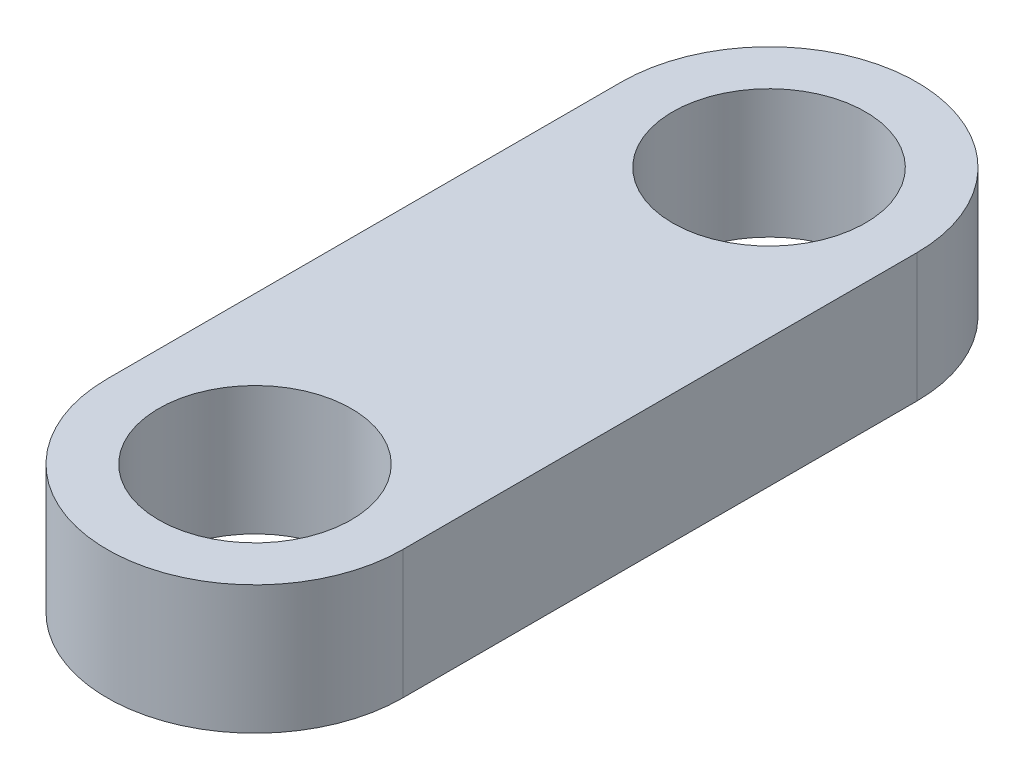
from build123d import *

# Parameters (mm, degrees)
SKETCH2_R           = 3.75
BOSS_EXTRUDE1_DEPTH = 5


with BuildPart() as part:
    # Sketch2 → Boss-Extrude1 (new body)
    with BuildSketch(Plane(origin=(0, 0, 0), x_dir=(1, 0, 0), z_dir=(0, 1, 0))):
        with BuildLine():
            Line((-5.75, 20), (-5.75, 0))
            ThreePointArc((-5.75, 0), (0, -5.75), (5.75, 0))
            Line((5.75, 0), (5.75, 20))
            ThreePointArc((5.75, 20), (0, 25.75), (-5.75, 20))
        make_face()
        with Locations(Location((0, 0, 0), (0, 0, 270))):
            Circle(SKETCH2_R, mode=Mode.SUBTRACT)
        with Locations(Location((0, 20, 0), (0, 0, 270))):
            Circle(SKETCH2_R, mode=Mode.SUBTRACT)
    extrude(amount=BOSS_EXTRUDE1_DEPTH)


solid = part.part
